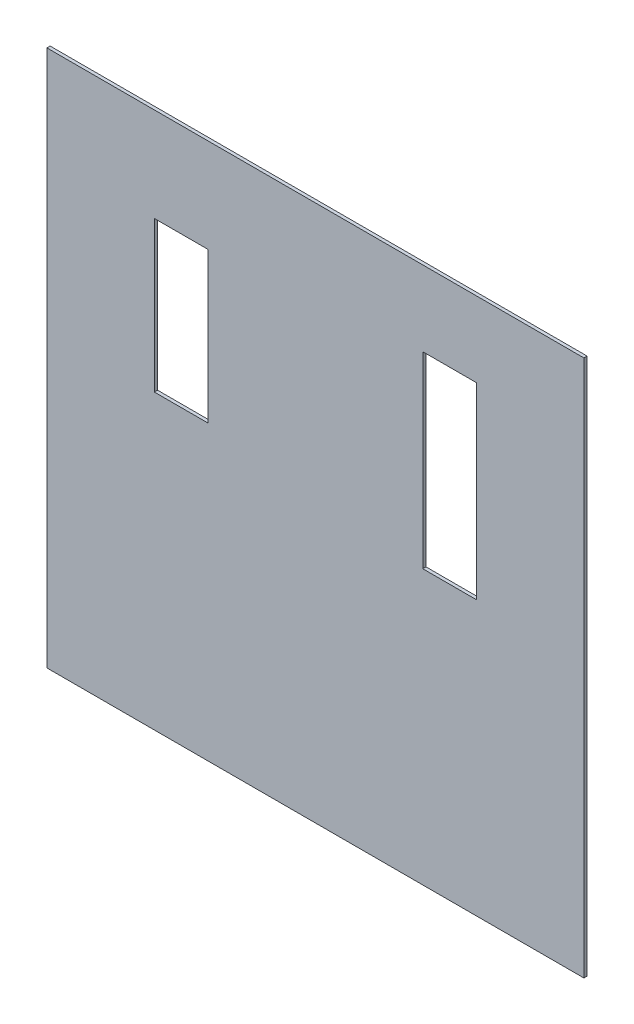
from build123d import *

# Parameters (mm, degrees)
SKETCH1_W           = 25.4
SKETCH1_H           = 25.4
BOSS_EXTRUDE1_DEPTH = 0.1524
SKETCH2_W           = 2.54
SKETCH2_H           = 7.112
SKETCH2_H_2         = 8.89
CUT_EXTRUDE1_DEPTH  = 36.921347772


with BuildPart() as part:
    # Sketch1 → Boss-Extrude1 (new body)
    with BuildSketch(Plane.XY):
        with Locations((12.7, 12.7)):
            Rectangle(SKETCH1_W, SKETCH1_H)
    extrude(amount=BOSS_EXTRUDE1_DEPTH)

    # Sketch2 → Cut-Extrude1 (cut, through all)
    with BuildSketch(Plane.XY.offset(0.1524)):
        with Locations((6.35, 17.399)):
            Rectangle(SKETCH2_W, SKETCH2_H)
        with Locations((19.05, 17.399)):
            Rectangle(SKETCH2_W, SKETCH2_H_2)
    extrude(amount=-CUT_EXTRUDE1_DEPTH, mode=Mode.SUBTRACT)


solid = part.part
